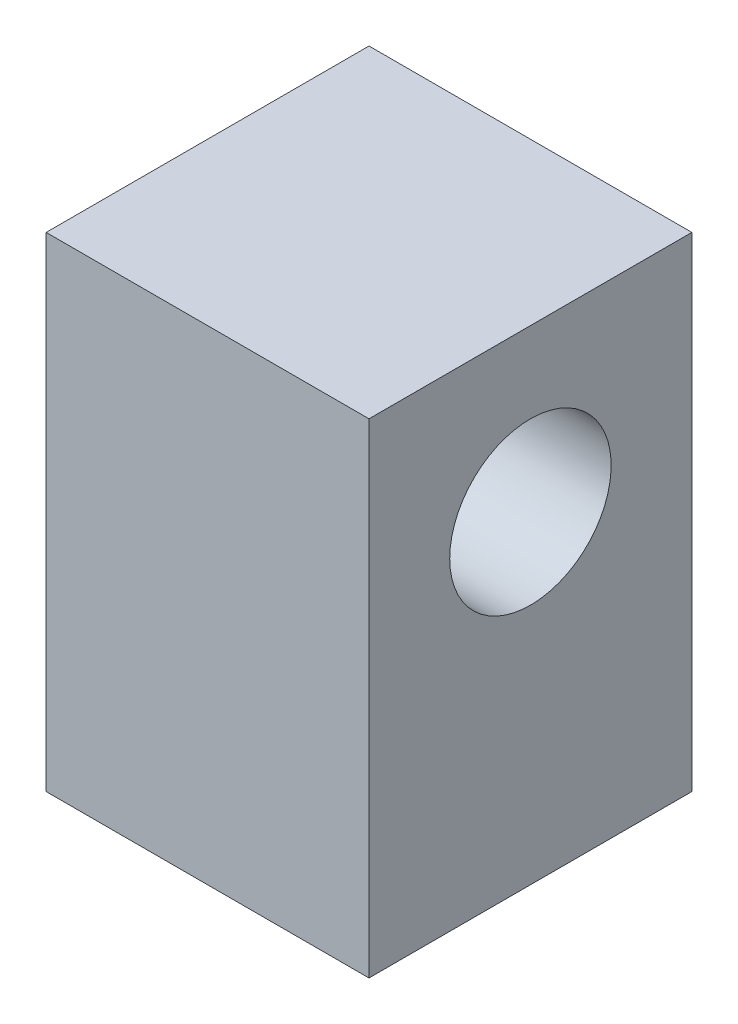
from build123d import *

# Parameters (mm, degrees)
SKETCH1_W           = 40
SKETCH1_H           = 40
BOSS_EXTRUDE1_DEPTH = 60
SKETCH2_R           = 10
CUT_EXTRUDE1_DEPTH  = 40


with BuildPart() as part:
    # Sketch1 → Boss-Extrude1 (new body)
    with BuildSketch(Plane(origin=(0, 0, 0), x_dir=(1, 0, 0), z_dir=(0, 1, 0))):
        Rectangle(SKETCH1_W, SKETCH1_H)
    extrude(amount=BOSS_EXTRUDE1_DEPTH)

    # Sketch2 → Cut-Extrude1 (cut)
    with BuildSketch(Plane.ZY.offset(20)):
        with Locations((0, 40)):
            Circle(SKETCH2_R)
    extrude(amount=-CUT_EXTRUDE1_DEPTH, mode=Mode.SUBTRACT)


solid = part.part
